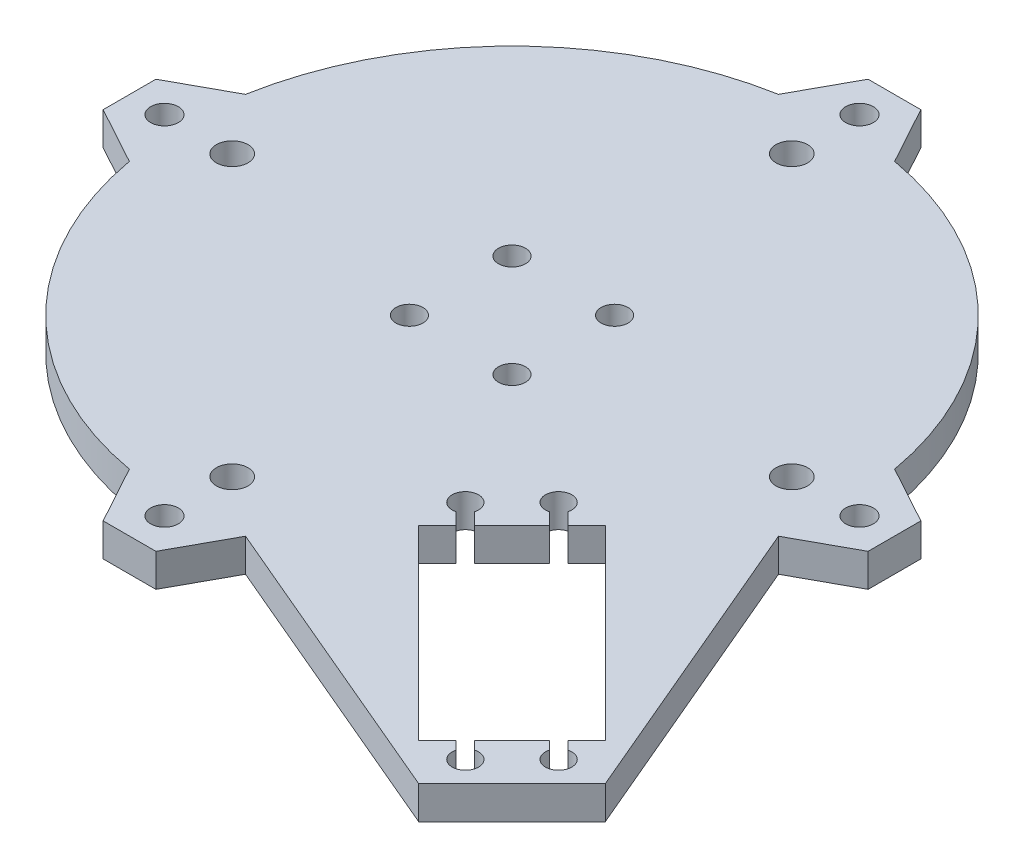
from build123d import *
from build123d.topology import SkipClean

# Parameters (mm, degrees)
SALIENTE_EXTRUIR1_DEPTH = 5
CROQUIS2_R              = 2.1
CORTAR_EXTRUIR1_DEPTH   = 83.176639016
CORTAR_EXTRUIR2_DEPTH   = 83.176639016
CROQUIS5_R              = 2.05
CORTAR_EXTRUIR4_DEPTH   = 83.176639016
SALIENTE_EXTRUIR2_DEPTH = 5
CORTAR_EXTRUIR10_DEPTH  = 98.128780493
SALIENTE_EXTRUIR4_DEPTH = 4
SALIENTE_EXTRUIR5_DEPTH = 4
CROQUIS17_R             = 2.4
CORTAR_EXTRUIR11_DEPTH  = 98.128780493


with BuildPart() as part:
    # Croquis1 → Saliente-Extruir1 (new body)
    with BuildSketch(Plane(origin=(0, 0, 0), x_dir=(1, 0, 0), z_dir=(0, 1, 0))):
        with BuildLine():
            Line((4, 58), (8.807070745, 49.218243619))
            ThreePointArc((8.807070745, 49.218243619), (35.355339059, 35.355339059), (49.218243619, 8.807070745))
            Line((49.218243619, 8.807070745), (58, 4))
            Line((58, 4), (58, -4))
            Line((58, -4), (49.218243619, -8.807070745))
            ThreePointArc((49.218243619, -8.807070745), (35.355339059, -35.355339059), (8.807070745, -49.218243619))
            Line((8.807070745, -49.218243619), (4, -58))
            Line((4, -58), (-4, -58))
            Line((-4, -58), (-8.807070745, -49.218243619))
            ThreePointArc((-8.807070745, -49.218243619), (-35.355339059, -35.355339059), (-49.218243619, -8.807070745))
            Line((-49.218243619, -8.807070745), (-58, -4))
            Line((-58, -4), (-58, 4))
            Line((-58, 4), (-49.218243619, 8.807070745))
            ThreePointArc((-49.218243619, 8.807070745), (-35.355339059, 35.355339059), (-8.807070745, 49.218243619))
            Line((-8.807070745, 49.218243619), (-4, 58))
            Line((-4, 58), (4, 58))
        make_face()
    extrude(amount=SALIENTE_EXTRUIR1_DEPTH)

    # Croquis2 → Cortar-Extruir1 (cut, through all)
    with BuildSketch(Plane(origin=(0, 5, 0), x_dir=(1, 0, 0), z_dir=(0, 1, 0))):
        with Locations(Location((0, 52.7, 0), (0, 0, 270))):
            Circle(CROQUIS2_R)
        with Locations(Location((52.7, 0, 0), (0, 0, 270))):
            Circle(CROQUIS2_R)
        with Locations(Location((0, -52.7, 0), (0, 0, 270))):
            Circle(CROQUIS2_R)
        with Locations(Location((-52.7, 0, 0), (0, 0, 270))):
            Circle(CROQUIS2_R)
    extrude(amount=-CORTAR_EXTRUIR1_DEPTH, mode=Mode.SUBTRACT)

    # Croquis3 → Cortar-Extruir2 (cut, through all)
    with BuildSketch(Plane(origin=(0, 5, 0), x_dir=(1, 0, 0), z_dir=(0, 1, 0))):
        Polygon((20.506096654, -34.648232278), (34.648232278, -20.506096654), (47.376154339, -33.234018716), (67.218949341, -53.076813717), (53.076813717, -67.218949341), (33.234018716, -47.376154339), align=None)
    extrude(amount=-CORTAR_EXTRUIR2_DEPTH, mode=Mode.SUBTRACT)

    # Croquis5 → Cortar-Extruir4 (cut, through all)
    with BuildSketch(Plane(origin=(0, 5, 0), x_dir=(1, 0, 0), z_dir=(0, 1, 0))):
        with Locations(Location((-7.78, 7.78, 0), (0, 0, 270))):
            Circle(CROQUIS5_R)
        with Locations(Location((7.78, 7.78, 0), (0, 0, 270))):
            Circle(CROQUIS5_R)
        with Locations(Location((7.78, -7.78, 0), (0, 0, 270))):
            Circle(CROQUIS5_R)
        with Locations(Location((-7.78, -7.78, 0), (0, 0, 270))):
            Circle(CROQUIS5_R)
        with BuildLine():
            Line((21.554064831, -30.039346205), (23.334523779, -31.819805153))
            Line((23.334523779, -31.819805153), (24.748737342, -30.405591591))
            Line((24.748737342, -30.405591591), (22.968278393, -28.625132642))
            ThreePointArc((22.968278393, -28.625132642), (19.622213178, -26.69328099), (21.554064831, -30.039346205))
        make_face()
        with BuildLine():
            Line((28.625132642, -22.968278393), (30.986174209, -25.329319959))
            Line((30.986174209, -25.329319959), (32.400387771, -23.915106397))
            Line((32.400387771, -23.915106397), (30.039346205, -21.554064831))
            ThreePointArc((30.039346205, -21.554064831), (26.69328099, -19.622213178), (28.625132642, -22.968278393))
        make_face()
    extrude(amount=-CORTAR_EXTRUIR4_DEPTH, mode=Mode.SUBTRACT)

    # Croquis7 → Saliente-Extruir2 (add, through all)
    with BuildSketch(Plane(origin=(0, 5, 0), x_dir=(1, 0, 0), z_dir=(0, 1, 0))):
        Polygon((68.589357775, -54.447222151), (54.447222151, -68.589357775), (8.807070745, -49.218243619), (18.571685103, -46.422973972), (27.56994834, -41.712083963), (48.790367902, -62.932503526), (62.932503526, -48.790367902), (41.712083963, -27.56994834), (46.422973972, -18.571685103), (49.218243619, -8.807070745), align=None)
    extrude(amount=-SALIENTE_EXTRUIR2_DEPTH)

    # Croquis8 → Cortar-Extruir10 (cut, through all)
    with BuildSketch(Plane(origin=(0, 5, 0), x_dir=(1, 0, 0), z_dir=(0, 1, 0))):
        with BuildLine():
            Line((54.283137452, -59.939991701), (51.490214314, -57.147068564))
            Line((51.490214314, -57.147068564), (50.076000752, -58.561282126))
            Line((50.076000752, -58.561282126), (52.868923889, -61.354205264))
            ThreePointArc((52.868923889, -61.354205264), (56.214989104, -63.286056916), (54.283137452, -59.939991701))
        make_face()
        with BuildLine():
            Line((57.371843354, -51.714989104), (58.786056916, -50.300775542))
            Line((58.786056916, -50.300775542), (61.354205264, -52.868923889))
            ThreePointArc((61.354205264, -52.868923889), (63.286056916, -56.214989104), (59.939991701, -54.283137452))
            Line((59.939991701, -54.283137452), (57.371843354, -51.714989104))
        make_face()
    extrude(amount=-CORTAR_EXTRUIR10_DEPTH, mode=Mode.SUBTRACT)

    # Croquis15 → Saliente-Extruir4 (add)
    with BuildSketch(Plane.XZ):
        with BuildLine():
            Line((-1.111111111, -20.469866441), (-1.111111111, -22.472548411))
            ThreePointArc((-1.111111111, -22.472548411), (0, 22.5), (1.111111111, -22.472548411))
            Line((1.111111111, -22.472548411), (1.111111111, -20.469866441))
            ThreePointArc((1.111111111, -20.469866441), (0, 20.5), (-1.111111111, -20.469866441))
        make_face()
    extrude(amount=SALIENTE_EXTRUIR4_DEPTH)

    # Croquis16 → Saliente-Extruir5 (add)
    with SkipClean():  # the faces are left unmerged after this step: merging them gives an invalid solid
        with BuildSketch(Plane.XZ):
            with BuildLine():
                Line((-1.111111111, -20.469866441), (-1.111111111, -22.472548411))
                ThreePointArc((-1.111111111, -22.472548411), (0, -22.5), (1.111111111, -22.472548411))
                Line((1.111111111, -22.472548411), (1.111111111, -20.469866441))
                ThreePointArc((1.111111111, -20.469866441), (0, -20.5), (-1.111111111, -20.469866441))
            make_face()
        extrude(amount=SALIENTE_EXTRUIR5_DEPTH)

    # Croquis17 → Cortar-Extruir11 (cut, through all)
    with SkipClean():  # the faces are left unmerged after this step: merging them gives an invalid solid
        with BuildSketch(Plane.XZ):
            with Locations(Location((42.43, 0, 0), (0, 0, 270))):
                Circle(CROQUIS17_R)
            with Locations(Location((0, -42.43, 0), (0, 0, 270))):
                Circle(CROQUIS17_R)
            with Locations(Location((-42.43, 0, 0), (0, 0, 270))):
                Circle(CROQUIS17_R)
            with Locations(Location((0, 42.43, 0), (0, 0, 270))):
                Circle(CROQUIS17_R)
        extrude(amount=-CORTAR_EXTRUIR11_DEPTH, mode=Mode.SUBTRACT)


solid = part.part
